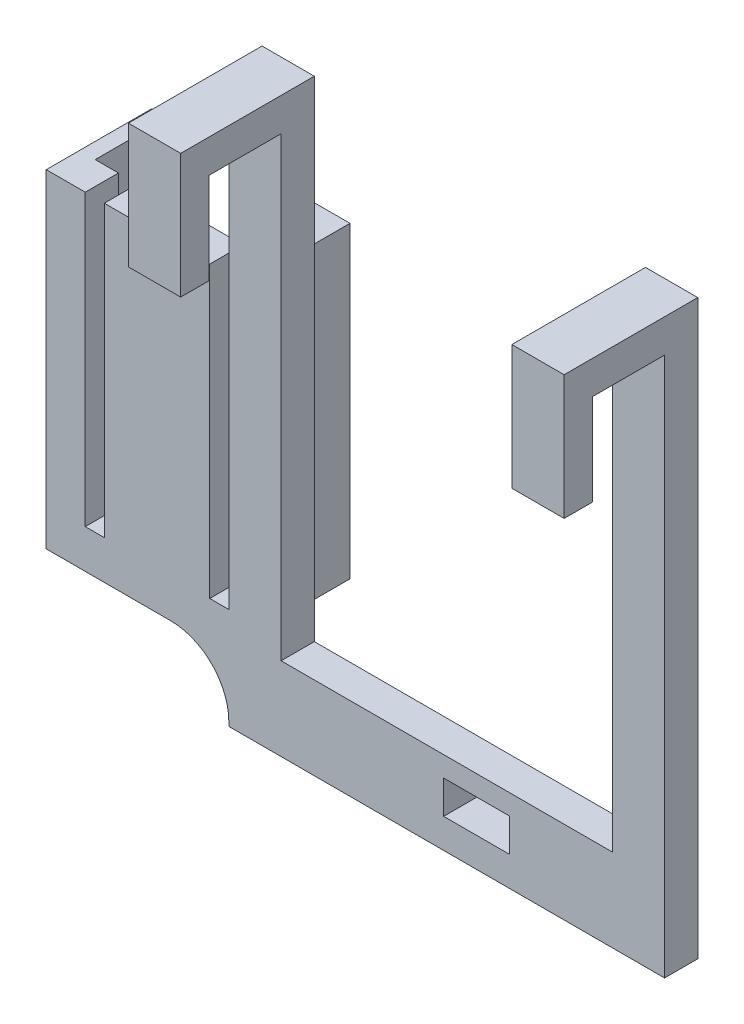
from build123d import *

# Parameters (mm, degrees)
SKETCH_1_W          = 6.3
SKETCH_1_H          = 59
SKETCH_1_W_2        = 52.5
SKETCH_1_H_2        = 10
EXTRUDE_1_DEPTH     = 4
SKETCH_2_W          = 6.3
SKETCH_2_H          = 4
EXTRUDE_2_DEPTH     = 12.1
SKETCH_3_W          = 6.3
SKETCH_3_H          = 3.4
EXTRUDE_3_DEPTH     = 11
SKETCH_4_W          = 6.3
SKETCH_4_H          = 3.4
EXTRUDE_4_DEPTH     = 11
SKETCH_5_W          = 4
SKETCH_5_H          = 39.574889558
EXTRUDE_5_DEPTH     = 22
SKETCH_6_W          = 2.3
SKETCH_6_H          = 37
CUT_EXTRUDE_1_DEPTH = 89.184238955
FILLET_1_R          = 7
SKETCH_7_W          = 7.91
SKETCH_7_H          = 4
CUT_EXTRUDE_2_DEPTH = 88.542332617
SKETCH_8_W          = 1.9
SKETCH_8_H          = 39.574889558
SKETCH_8_H_2        = 37.097175278
EXTRUDE_6_DEPTH     = 12.7
SKETCH_9_W          = 3
SKETCH_9_H          = 39.574889558
EXTRUDE_7_DEPTH     = 3.5
SKETCH_10_W         = 3
SKETCH_10_H         = 37.097175278
EXTRUDE_8_DEPTH     = 3.5


with BuildPart() as part:
    # Эскиз1 → Бобышка-Вытянуть1 (new body)
    with BuildSketch(Plane.XY):
        with Locations((3.15, 39.5)):
            Rectangle(SKETCH_1_W, SKETCH_1_H)
        with Locations((26.25, 5)):
            Rectangle(SKETCH_1_W_2, SKETCH_1_H_2)
        with Locations((49.35, 39.5)):
            Rectangle(SKETCH_1_W, SKETCH_1_H)
    extrude(amount=EXTRUDE_1_DEPTH)

    # Эскиз2 → Бобышка-Вытянуть2 (add)
    with BuildSketch(Plane.XY.offset(4)):
        with Locations((3.15, 67)):
            Rectangle(SKETCH_2_W, SKETCH_2_H)
        with Locations((49.35, 67)):
            Rectangle(SKETCH_2_W, SKETCH_2_H)
    extrude(amount=EXTRUDE_2_DEPTH)

    # Эскиз3 → Бобышка-Вытянуть3 (add)
    with BuildSketch(Plane.XZ.offset(-65)):
        with Locations((49.35, 14.4)):
            Rectangle(SKETCH_3_W, SKETCH_3_H)
    extrude(amount=EXTRUDE_3_DEPTH)

    # Эскиз4 → Бобышка-Вытянуть4 (add)
    with BuildSketch(Plane.XZ.offset(-65)):
        with Locations((3.15, 14.4)):
            Rectangle(SKETCH_4_W, SKETCH_4_H)
    extrude(amount=EXTRUDE_4_DEPTH)

    # Эскиз5 → Бобышка-Вытянуть5 (add)
    with BuildSketch(Plane.ZY):
        with Locations((2, 27.309730499)):
            Rectangle(SKETCH_5_W, SKETCH_5_H)
    extrude(amount=EXTRUDE_5_DEPTH)

    # Эскиз6 → Вырез-Вытянуть1 (cut, through all)
    with BuildSketch(Plane(origin=(0, 0, 0), x_dir=(-1, 0, 0), z_dir=(0, 0, -1))):
        with Locations((1.15, 30.7)):
            Rectangle(SKETCH_6_W, SKETCH_6_H)
        with Locations((16.15, 30.7)):
            Rectangle(SKETCH_6_W, SKETCH_6_H)
    extrude(amount=-CUT_EXTRUDE_1_DEPTH, mode=Mode.SUBTRACT)

    # Скругление1
    fillet_1_edges = [part.edges().sort_by_distance(p)[0] for p in [
        (0, 7.52228572, 2),
    ]]
    fillet(fillet_1_edges, radius=FILLET_1_R)

    # Эскиз7 → Вырез-Вытянуть2 (cut, through all)
    with BuildSketch(Plane.XY.offset(4)):
        with Locations((29.837829831, 5.560133135)):
            Rectangle(SKETCH_7_W, SKETCH_7_H)
    extrude(amount=-CUT_EXTRUDE_2_DEPTH, mode=Mode.SUBTRACT)

    # Эскиз8 → Бобышка-Вытянуть6 (add)
    with BuildSketch(Plane.XY.offset(4)):
        with Locations((-21.05, 27.309730499)):
            Rectangle(SKETCH_8_W, SKETCH_8_H)
        with Locations((0.95, 28.548587639)):
            Rectangle(SKETCH_8_W, SKETCH_8_H_2)
    extrude(amount=-EXTRUDE_6_DEPTH)

    # Эскиз9 → Бобышка-Вытянуть7 (add)
    with BuildSketch(Plane(origin=(-20.1, 0, 0), x_dir=(0, 0, -1), z_dir=(1, 0, 0))):
        with Locations((7.2, 27.309730499)):
            Rectangle(SKETCH_9_W, SKETCH_9_H)
    extrude(amount=EXTRUDE_7_DEPTH)

    # Эскиз10 → Бобышка-Вытянуть8 (add)
    with BuildSketch(Plane.ZY):
        with Locations((-7.2, 28.548587639)):
            Rectangle(SKETCH_10_W, SKETCH_10_H)
    extrude(amount=EXTRUDE_8_DEPTH)


solid = part.part
